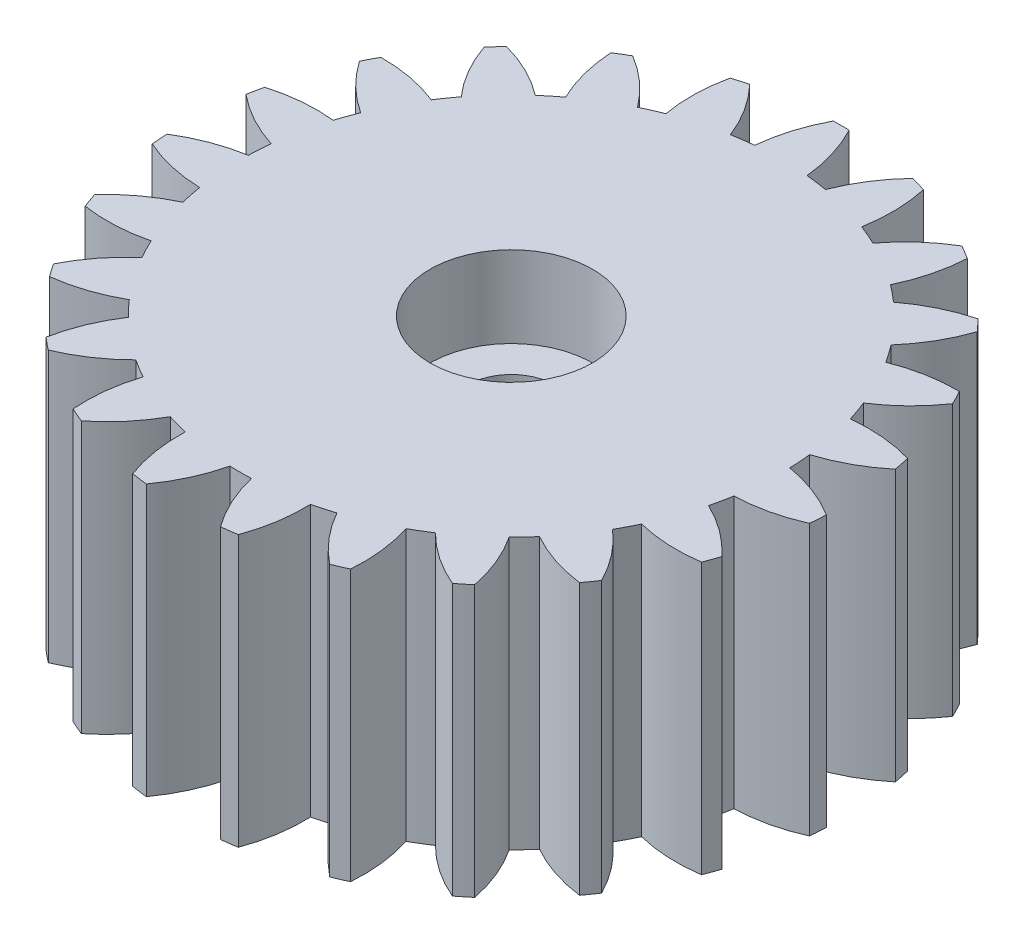
from build123d import *

# Parameters (mm, degrees)
SKETCH1_R           = 10
BOSS_EXTRUDE1_DEPTH = 10
BOSS_EXTRUDE2_DEPTH = 10
SKETCH4_R           = 2.825
CUT_EXTRUDE1_DEPTH  = 3.7
SKETCH5_R           = 1.6
CUT_EXTRUDE2_DEPTH  = 20.917820636
SKETCH7_R           = 3
CUT_EXTRUDE3_DEPTH  = 3


with BuildPart() as part:
    # Sketch1 → Boss-Extrude1 (new body)
    with BuildSketch(Plane(origin=(0, 0, 0), x_dir=(1, 0, 0), z_dir=(0, 1, 0))):
        with Locations(Location((0, 0, 0), (0, 0, 270))):
            Circle(SKETCH1_R)
    extrude(amount=BOSS_EXTRUDE1_DEPTH)

    # Sketch3 → Boss-Extrude2 (add)
    with BuildSketch(Plane(origin=(0, 10, 0), x_dir=(1, 0, 0), z_dir=(0, 1, 0))):
        with BuildLine():
            ThreePointArc((-0.292653692, 12.182759316), (-0.746983902, 11.075453202), (-0.972488982, 9.9))
            ThreePointArc((-0.972488982, 9.9), (0, 9.947649713), (0.972488982, 9.9))
            ThreePointArc((0.972488982, 9.9), (0.746983902, 11.075453202), (0.292653692, 12.182759316))
            ThreePointArc((0.292653692, 12.182759316), (0, 12.186273866), (-0.292653692, 12.182759316))
        make_face()
        with BuildLine():
            ThreePointArc((3.005067828, 11.809946574), (2.2688378, 10.866279198), (1.734561582, 9.795255532))
            ThreePointArc((1.734561582, 9.795255532), (2.683843773, 9.578763877), (3.607414487, 9.270506757))
            ThreePointArc((3.607414487, 9.270506757), (3.707405226, 10.463211508), (3.568670426, 11.652032532))
            ThreePointArc((3.568670426, 11.652032532), (3.287817341, 11.734373774), (3.005067828, 11.809946574))
        make_face()
        with BuildLine():
            ThreePointArc((6.079917215, 10.561244121), (5.116390182, 9.851202976), (4.312967649, 8.964041772))
            ThreePointArc((4.312967649, 8.964041772), (5.168639132, 8.499464945), (5.974794562, 7.953462438))
            ThreePointArc((5.974794562, 7.953462438), (6.392865264, 9.074961283), (6.580015201, 10.257127799))
            ThreePointArc((6.580015201, 10.257127799), (6.331792311, 10.41218886), (6.079917215, 10.561244121))
        make_face()
        with BuildLine():
            ThreePointArc((8.703846955, 8.529262507), (7.58448331, 8.105508096), (6.571500635, 7.468006041))
            ThreePointArc((6.571500635, 7.468006041), (7.270100171, 6.789799579), (7.899051458, 6.046546195))
            ThreePointArc((7.899051458, 6.046546195), (8.604195731, 7.013662695), (9.103350349, 8.101498821))
            ThreePointArc((9.103350349, 8.101498821), (8.906167212, 8.317779531), (8.703846955, 8.529262507))
        make_face()
        with BuildLine():
            ThreePointArc((10.682252184, 5.864704511), (9.490070008, 5.758664761), (8.342655482, 5.418102466))
            ThreePointArc((8.342655482, 5.418102466), (8.832371138, 4.576565841), (9.237471842, 3.691185281))
            ThreePointArc((9.237471842, 3.691185281), (10.177392362, 4.43219283), (10.951531647, 5.345018737))
            ThreePointArc((10.951531647, 5.345018737), (10.820012433, 5.606478546), (10.682252184, 5.864704511))
        make_face()
        with BuildLine():
            ThreePointArc((11.868403637, 2.765188211), (10.691821627, 2.984727604), (9.495073737, 2.966363017))
            ThreePointArc((9.495073737, 2.966363017), (9.739585544, 2.02390915), (9.890791199, 1.062066042))
            ThreePointArc((9.890791199, 1.062066042), (10.99577836, 1.522007499), (11.987487943, 2.192123066))
            ThreePointArc((11.987487943, 2.192123066), (11.93138683, 2.479370695), (11.868403637, 2.765188211))
        make_face()
        with BuildLine():
            ThreePointArc((12.174329886, -0.539409449), (11.100609748, -0.010573145), (9.94328581, 0.294621993))
            ThreePointArc((9.94328581, 0.294621993), (9.924459446, -0.678851624), (9.81055582, -1.645821778))
            ThreePointArc((9.81055582, -1.645821778), (10.99865778, -1.501058166), (12.134387098, -1.123352345))
            ThreePointArc((12.134387098, -1.123352345), (12.157864849, -0.831620739), (12.174329886, -0.539409449))
        make_face()
        with BuildLine():
            ThreePointArc((11.577341782, -3.804001578), (10.686116426, -3.005089732), (9.654049862, -2.398969796))
            ThreePointArc((9.654049862, -2.398969796), (9.373281592, -3.331265078), (9.002716396, -4.231646525))
            ThreePointArc((9.002716396, -4.231646525), (10.185817067, -4.412797214), (11.381334272, -4.355513852))
            ThreePointArc((11.381334272, -4.355513852), (11.48264965, -4.080934666), (11.577341782, -3.804001578))
        make_face()
        with BuildLine():
            ThreePointArc((10.1217152, -6.786468311), (9.479082735, -5.776732561), (8.6488172, -4.914640969))
            ThreePointArc((8.6488172, -4.914640969), (8.126930322, -5.736613841), (7.527186681, -6.503629408))
            ThreePointArc((7.527186681, -6.503629408), (8.6175409, -6.997259279), (9.78417995, -7.264646822))
            ThreePointArc((9.78417995, -7.264646822), (9.955818856, -7.027584338), (10.1217152, -6.786468311))
        make_face()
        with BuildLine():
            ThreePointArc((7.915407306, -9.265613737), (7.569028841, -8.119941563), (7.002141332, -7.065815706))
            ThreePointArc((7.002141332, -7.065815706), (6.277841808, -7.716504199), (5.493399966, -8.29326785))
            ThreePointArc((5.493399966, -8.29326785), (6.410141146, -9.062766634), (7.46137776, -9.63499417))
            ThreePointArc((7.46137776, -9.63499417), (7.690610523, -9.453030229), (7.915407306, -9.265613737))
        make_face()
        with BuildLine():
            ThreePointArc((5.122049862, -11.057570978), (5.097614704, -9.860931645), (4.836148674, -8.692951215))
            ThreePointArc((4.836148674, -8.692951215), (3.963154487, -9.124096741), (3.052192905, -9.467832555))
            ThreePointArc((3.052192905, -9.467832555), (3.727330549, -10.456130047), (4.585199315, -11.290758078))
            ThreePointArc((4.585199315, -11.290758078), (4.855024789, -11.177388113), (5.122049862, -11.057570978))
        make_face()
        with BuildLine():
            ThreePointArc((1.948813412, -12.029438766), (2.248133804, -10.870581538), (2.311480993, -9.6753703))
            ThreePointArc((2.311480993, -9.6753703), (1.354538128, -9.854996767), (0.384618659, -9.940211432))
            ThreePointArc((0.384618659, -9.940211432), (0.768080896, -11.074010128), (1.368957613, -12.109138111))
            ThreePointArc((1.368957613, -12.109138111), (1.659364077, -12.072770253), (1.948813412, -12.029438766))
        make_face()
        with BuildLine():
            ThreePointArc((-1.368957613, -12.109138111), (-0.768080896, -11.074010128), (-0.384618659, -9.940211432))
            ThreePointArc((-0.384618659, -9.940211432), (-1.354538128, -9.854996767), (-2.311480993, -9.6753703))
            ThreePointArc((-2.311480993, -9.6753703), (-2.248133804, -10.870581538), (-1.948813412, -12.029438766))
            ThreePointArc((-1.948813412, -12.029438766), (-1.659364077, -12.072770253), (-1.368957613, -12.109138111))
        make_face()
        with BuildLine():
            ThreePointArc((-4.585199315, -11.290758078), (-3.727330549, -10.456130047), (-3.052192905, -9.467832555))
            ThreePointArc((-3.052192905, -9.467832555), (-3.963154487, -9.124096741), (-4.836148674, -8.692951215))
            ThreePointArc((-4.836148674, -8.692951215), (-5.097614704, -9.860931645), (-5.122049862, -11.057570978))
            ThreePointArc((-5.122049862, -11.057570978), (-4.855024789, -11.177388113), (-4.585199315, -11.290758078))
        make_face()
        with BuildLine():
            ThreePointArc((-7.46137776, -9.63499417), (-6.410141146, -9.062766634), (-5.493399966, -8.29326785))
            ThreePointArc((-5.493399966, -8.29326785), (-6.277841808, -7.716504199), (-7.002141332, -7.065815706))
            ThreePointArc((-7.002141332, -7.065815706), (-7.569028841, -8.119941563), (-7.915407306, -9.265613737))
            ThreePointArc((-7.915407306, -9.265613737), (-7.690610523, -9.453030229), (-7.46137776, -9.63499417))
        make_face()
        with BuildLine():
            ThreePointArc((-9.78417995, -7.264646822), (-8.6175409, -6.997259279), (-7.527186681, -6.503629408))
            ThreePointArc((-7.527186681, -6.503629408), (-8.126930322, -5.736613841), (-8.6488172, -4.914640969))
            ThreePointArc((-8.6488172, -4.914640969), (-9.479082735, -5.776732561), (-10.1217152, -6.786468311))
            ThreePointArc((-10.1217152, -6.786468311), (-9.955818856, -7.027584338), (-9.78417995, -7.264646822))
        make_face()
        with BuildLine():
            ThreePointArc((-11.381334272, -4.355513852), (-10.185817067, -4.412797214), (-9.002716396, -4.231646525))
            ThreePointArc((-9.002716396, -4.231646525), (-9.373281592, -3.331265078), (-9.654049862, -2.398969796))
            ThreePointArc((-9.654049862, -2.398969796), (-10.686116426, -3.005089732), (-11.577341782, -3.804001578))
            ThreePointArc((-11.577341782, -3.804001578), (-11.48264965, -4.080934666), (-11.381334272, -4.355513852))
        make_face()
        with BuildLine():
            ThreePointArc((-12.134387098, -1.123352345), (-10.99865778, -1.501058166), (-9.81055582, -1.645821778))
            ThreePointArc((-9.81055582, -1.645821778), (-9.924459446, -0.678851624), (-9.94328581, 0.294621993))
            ThreePointArc((-9.94328581, 0.294621993), (-11.100609748, -0.010573145), (-12.174329886, -0.539409449))
            ThreePointArc((-12.174329886, -0.539409449), (-12.157864849, -0.831620739), (-12.134387098, -1.123352345))
        make_face()
        with BuildLine():
            ThreePointArc((-11.987487943, 2.192123066), (-10.99577836, 1.522007499), (-9.890791199, 1.062066042))
            ThreePointArc((-9.890791199, 1.062066042), (-9.739585544, 2.02390915), (-9.495073737, 2.966363017))
            ThreePointArc((-9.495073737, 2.966363017), (-10.691821627, 2.984727604), (-11.868403637, 2.765188211))
            ThreePointArc((-11.868403637, 2.765188211), (-11.93138683, 2.479370695), (-11.987487943, 2.192123066))
        make_face()
        with BuildLine():
            ThreePointArc((-10.951531647, 5.345018737), (-10.177392362, 4.43219283), (-9.237471842, 3.691185281))
            ThreePointArc((-9.237471842, 3.691185281), (-8.832371138, 4.576565841), (-8.342655482, 5.418102466))
            ThreePointArc((-8.342655482, 5.418102466), (-9.490070008, 5.758664761), (-10.682252184, 5.864704511))
            ThreePointArc((-10.682252184, 5.864704511), (-10.820012433, 5.606478546), (-10.951531647, 5.345018737))
        make_face()
        with BuildLine():
            ThreePointArc((-9.103350349, 8.101498821), (-8.604195731, 7.013662695), (-7.899051458, 6.046546195))
            ThreePointArc((-7.899051458, 6.046546195), (-7.270100171, 6.789799579), (-6.571500635, 7.468006041))
            ThreePointArc((-6.571500635, 7.468006041), (-7.58448331, 8.105508096), (-8.703846955, 8.529262507))
            ThreePointArc((-8.703846955, 8.529262507), (-8.906167212, 8.317779531), (-9.103350349, 8.101498821))
        make_face()
        with BuildLine():
            ThreePointArc((-6.580015201, 10.257127799), (-6.392865264, 9.074961283), (-5.974794562, 7.953462438))
            ThreePointArc((-5.974794562, 7.953462438), (-5.168639132, 8.499464945), (-4.312967649, 8.964041772))
            ThreePointArc((-4.312967649, 8.964041772), (-5.116390182, 9.851202976), (-6.079917215, 10.561244121))
            ThreePointArc((-6.079917215, 10.561244121), (-6.331792311, 10.41218886), (-6.580015201, 10.257127799))
        make_face()
        with BuildLine():
            ThreePointArc((-3.568670426, 11.652032532), (-3.707405226, 10.463211508), (-3.607414487, 9.270506757))
            ThreePointArc((-3.607414487, 9.270506757), (-2.683843773, 9.578763877), (-1.734561582, 9.795255532))
            ThreePointArc((-1.734561582, 9.795255532), (-2.2688378, 10.866279198), (-3.005067828, 11.809946574))
            ThreePointArc((-3.005067828, 11.809946574), (-3.287817341, 11.734373774), (-3.568670426, 11.652032532))
        make_face()
    extrude(amount=-BOSS_EXTRUDE2_DEPTH)

    # Sketch4 → Cut-Extrude1 (cut)
    with BuildSketch(Plane.XZ):
        with Locations(Location((0, 0, 0), (0, 0, 270))):
            Circle(SKETCH4_R)
    extrude(amount=-CUT_EXTRUDE1_DEPTH, mode=Mode.SUBTRACT)

    # Sketch5 → Cut-Extrude2 (cut, through all)
    with BuildSketch(Plane(origin=(0, 10, 0), x_dir=(1, 0, 0), z_dir=(0, 1, 0))):
        with Locations(Location((0, 0, 0), (0, 0, 270))):
            Circle(SKETCH5_R)
    extrude(amount=-CUT_EXTRUDE2_DEPTH, mode=Mode.SUBTRACT)

    # Sketch7 → Cut-Extrude3 (cut)
    with BuildSketch(Plane(origin=(0, 10, 0), x_dir=(1, 0, 0), z_dir=(0, 1, 0))):
        with Locations(Location((0, 0, 0), (0, 0, 270))):
            Circle(SKETCH7_R)
    extrude(amount=-CUT_EXTRUDE3_DEPTH, mode=Mode.SUBTRACT)


solid = part.part
